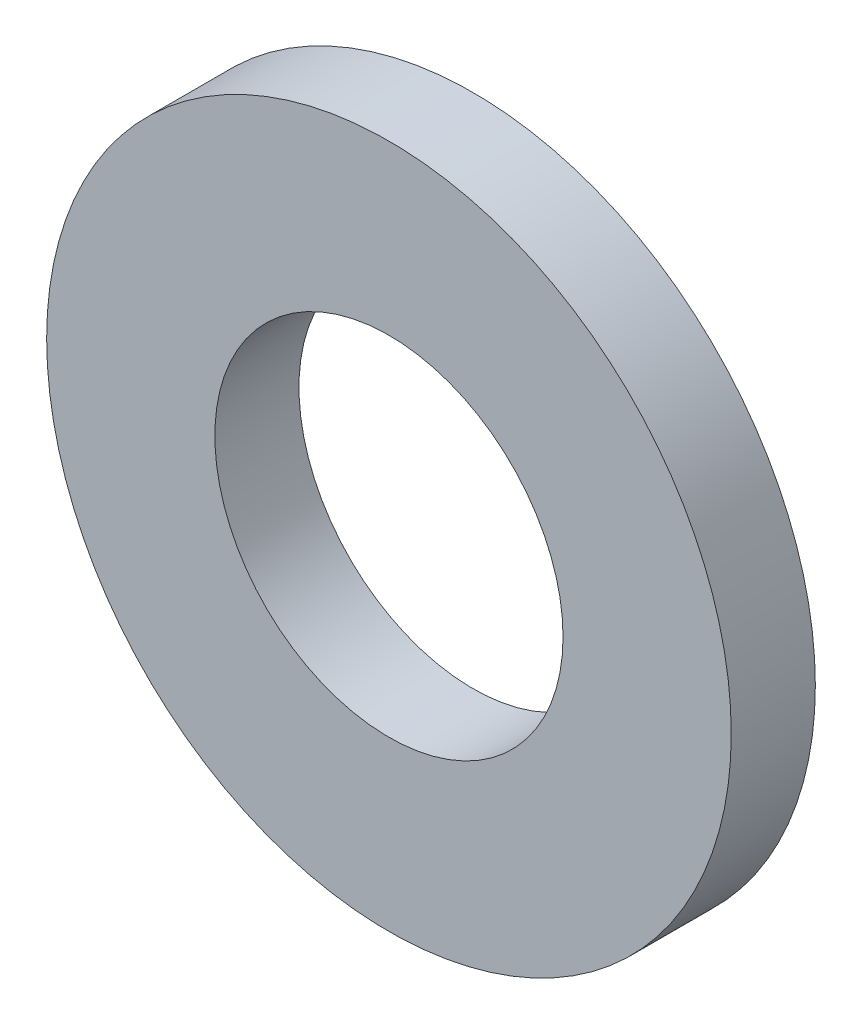
from build123d import *

# Parameters (mm, degrees)
ESQUISSE1_R        = 20.35
ESQUISSE1_R_2      = 10.35
BOSS_EXTRU_1_DEPTH = 5


with BuildPart() as part:
    # Esquisse1 → Boss.-Extru.1 (new body)
    with BuildSketch(Plane.XY):
        Circle(ESQUISSE1_R)
        Circle(ESQUISSE1_R_2, mode=Mode.SUBTRACT)
    extrude(amount=BOSS_EXTRU_1_DEPTH)


solid = part.part
